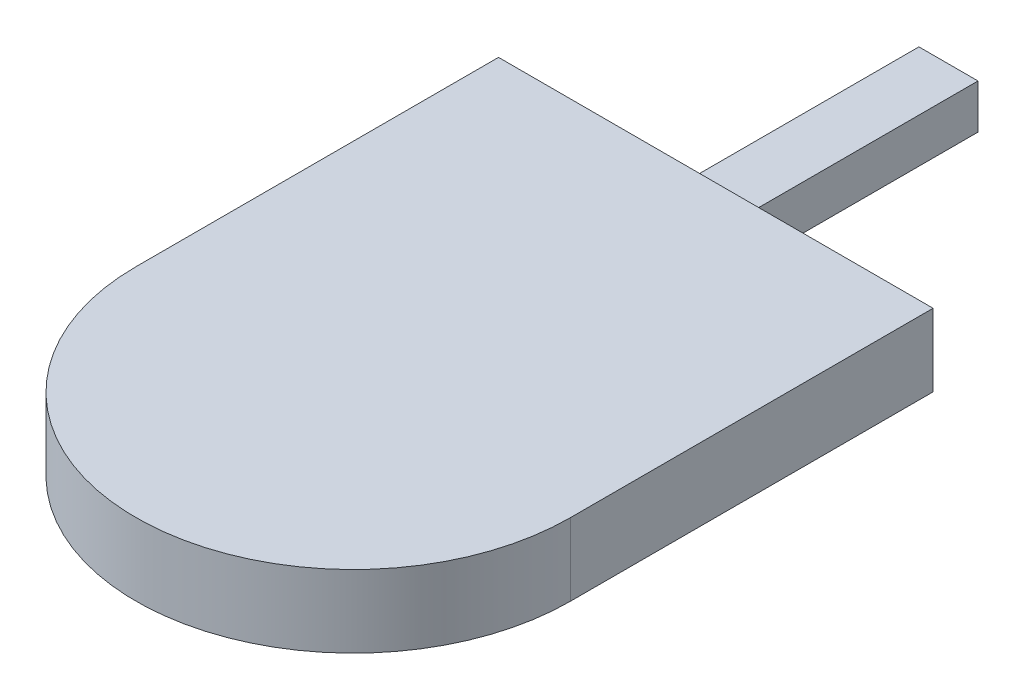
from build123d import *

# Parameters (mm, degrees)
SALIENTE_EXTRUIR1_DEPTH = 8
CROQUIS2_W              = 6.524931815
CROQUIS2_H              = 4.893891774
SALIENTE_EXTRUIR2_DEPTH = 25


with BuildPart() as part:
    # Croquis1 → Saliente-Extruir1 (new body)
    with BuildSketch(Plane(origin=(0, 0, 0), x_dir=(1, 0, 0), z_dir=(0, 1, 0))):
        with BuildLine():
            Line((11.999210506, 0), (0, 0))
            Line((0, 0), (-11.999210506, 0))
            Line((-11.999210506, 0), (-23.998421012, 0))
            Line((-23.998421012, 0), (-23.998421012, -40.04621649))
            ThreePointArc((-23.998421012, -40.04621649), (0, -64.044637502), (23.998421012, -40.04621649))
            Line((23.998421012, -40.04621649), (23.998421012, 0))
            Line((23.998421012, 0), (11.999210506, 0))
        make_face()
    extrude(amount=SALIENTE_EXTRUIR1_DEPTH)

    # Croquis2 → Saliente-Extruir2 (add)
    with BuildSketch(Plane(origin=(0, 0, 0), x_dir=(-1, 0, 0), z_dir=(0, 0, -1))):
        with Locations((-0.697117267, 4.775150066)):
            Rectangle(CROQUIS2_W, CROQUIS2_H)
    extrude(amount=SALIENTE_EXTRUIR2_DEPTH)


solid = part.part
